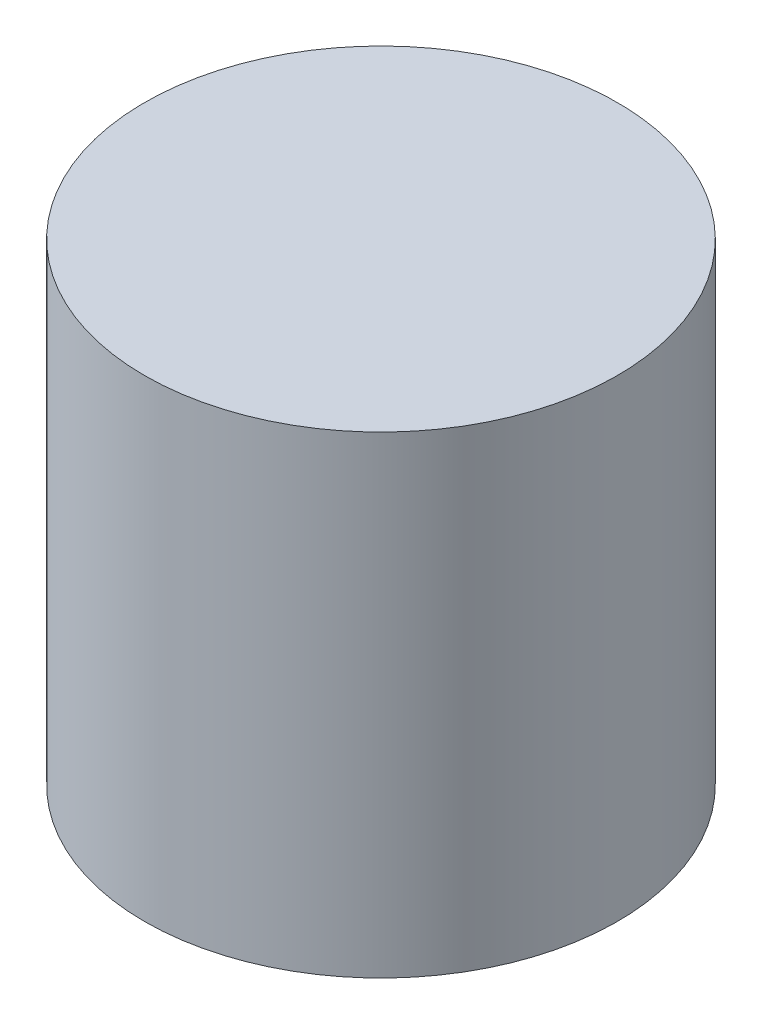
from build123d import *

# Parameters (mm, degrees)
SKETCH1_R           = 3.175
BOSS_EXTRUDE1_DEPTH = 6.35
SKETCH2_R           = 0.396875
CUT_EXTRUDE1_DEPTH  = 2.116666667


with BuildPart() as part:
    # Sketch1 → Boss-Extrude1 (new body)
    with BuildSketch(Plane(origin=(0, 0, 0), x_dir=(1, 0, 0), z_dir=(0, 1, 0))):
        with Locations(Location((0, 0, 0), (0, 0, 270))):
            Circle(SKETCH1_R)
    extrude(amount=BOSS_EXTRUDE1_DEPTH)

    # Sketch2 → Cut-Extrude1 (cut)
    with BuildSketch(Plane.XZ):
        with Locations(Location((1.984375, 0, 0), (0, 0, 270))):
            Circle(SKETCH2_R)
        with Locations(Location((-1.984375, 0, 0), (0, 0, 270))):
            Circle(SKETCH2_R)
    extrude(amount=-CUT_EXTRUDE1_DEPTH, mode=Mode.SUBTRACT)


solid = part.part
